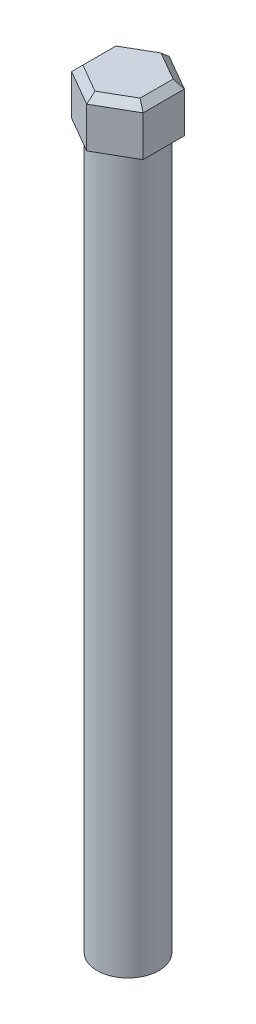
from build123d import *

# Parameters (mm, degrees)
SKETCH1_W           = 0.13
SKETCH1_H           = 3
BOSS_EXTRUDE1_DEPTH = 0.2
CHAMFER5_SIZE       = 0.03


with BuildPart() as part:
    # Sketch1 → Revolve2 (revolve)
    with BuildSketch(Plane.XY):
        with Locations((0.065, 1.5)):
            Rectangle(SKETCH1_W, SKETCH1_H)
    revolve(axis=Axis((0, 0, 0), (0, 1, 0)))

    # Sketch3 → Boss-Extrude1 (add)
    with BuildSketch(Plane(origin=(0, 3, 0), x_dir=(1, 0, 0), z_dir=(0, 1, 0))):
        Polygon((0, 0.173205081), (-0.15, 0.08660254), (-0.15, -0.08660254), (0, -0.173205081), (0.15, -0.08660254), (0.15, 0.08660254), align=None)
    extrude(amount=BOSS_EXTRUDE1_DEPTH)

    # Chamfer5
    chamfer5_edges = [part.edges().sort_by_distance(p)[0] for p in [
        (0.075, 3.2, -0.129903811),
        (-0.075, 3.2, -0.129903811),
        (-0.15, 3.2, 0),
        (-0.075, 3.2, 0.129903811),
        (0.075, 3.2, 0.129903811),
        (0.15, 3.2, 0),
    ]]
    chamfer(chamfer5_edges, length=CHAMFER5_SIZE)


solid = part.part
